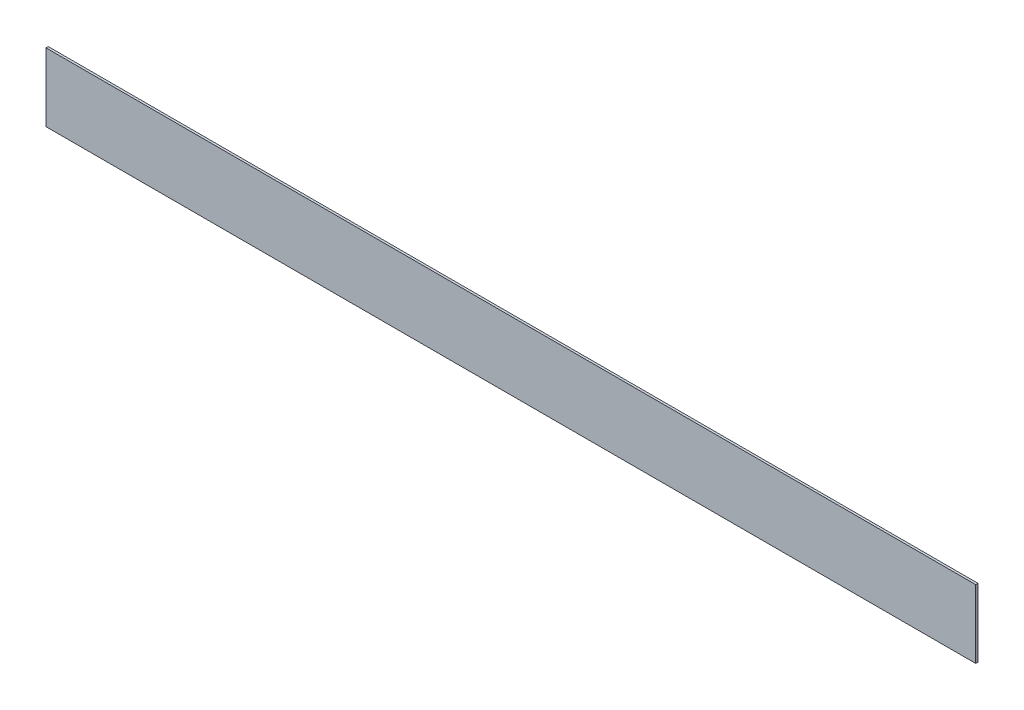
from build123d import *

# Parameters (mm, degrees)
SKETCH_1_W      = 2056
SKETCH_1_H      = 151
EXTRUDE_1_DEPTH = 5


with BuildPart() as part:
    # 草图1 → 凸台-拉伸1 (new body)
    with BuildSketch(Plane.XY):
        with Locations((1028, 75.5)):
            Rectangle(SKETCH_1_W, SKETCH_1_H)
    extrude(amount=EXTRUDE_1_DEPTH)


solid = part.part
